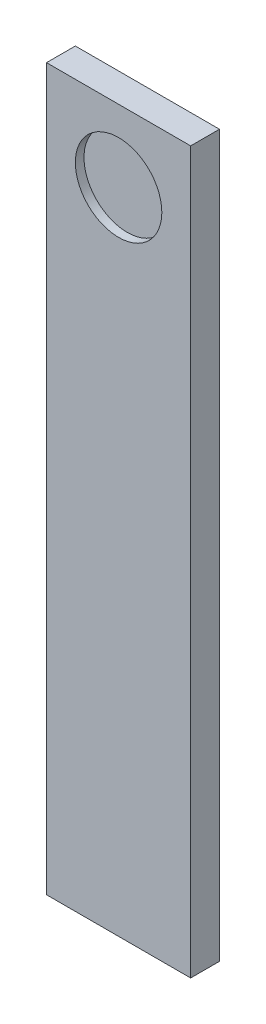
from build123d import *

# Parameters (mm, degrees)
SKETCH1_W           = 50
SKETCH1_H           = 250
BOSS_EXTRUDE1_DEPTH = 5
SKETCH2_R           = 15
CUT_EXTRUDE1_DEPTH  = 3
SKETCH5_R           = 15
CUT_EXTRUDE2_DEPTH  = 3


with BuildPart() as part:
    # Sketch1 → Boss-Extrude1 (new, symmetric)
    with BuildSketch(Plane.XY):
        Rectangle(SKETCH1_W, SKETCH1_H)
    extrude(amount=BOSS_EXTRUDE1_DEPTH, both=True)

    # Sketch2 → Cut-Extrude1 (cut)
    with BuildSketch(Plane.XY.offset(5)):
        with Locations((0, 100)):
            Circle(SKETCH2_R)
    extrude(amount=-CUT_EXTRUDE1_DEPTH, mode=Mode.SUBTRACT)

    # Sketch5 → Cut-Extrude2 (cut)
    with BuildSketch(Plane(origin=(0, 0, -5), x_dir=(-1, 0, 0), z_dir=(0, 0, -1))):
        with Locations((0, -100)):
            Circle(SKETCH5_R)
    extrude(amount=-CUT_EXTRUDE2_DEPTH, mode=Mode.SUBTRACT)


solid = part.part
